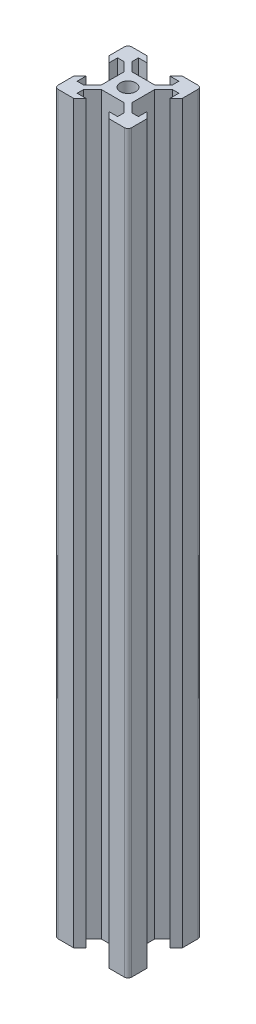
from build123d import *

# Parameters (mm, degrees)
MASTERLAYOUTSKETCH_R  = 2.1
MAIN_EXTRUSION_DEPTH  = 200
EDGE_FILLETS_R        = 1
M5_TAPPED_HOLE1_D     = 4.2
M5_TAPPED_HOLE1_DEPTH = 12.4
M5_TAPPED_HOLE1_TIP   = 1.2618073


with BuildPart() as part:
    # MasterLayoutSketch → Main Extrusion (new body)
    with BuildSketch(Plane(origin=(0, 0, 0), x_dir=(1, 0, 0), z_dir=(0, 1, 0))):
        Polygon((-8.325, 3.1), (-8.325, 5.5), (-6.560660172, 5.5), (-4.160660172, 3.1), (-4.160660172, -3.1), (-6.560660172, -5.5), (-8.325, -5.5), (-8.325, -3.1), (-10, -4.775), (-10, -10), (-4.775, -10), (-3.1, -8.325), (-5.5, -8.325), (-5.5, -6.560660172), (-3.1, -4.160660172), (3.1, -4.160660172), (5.5, -6.560660172), (5.5, -8.325), (3.1, -8.325), (4.775, -10), (10, -10), (10, -4.775), (8.325, -3.1), (8.325, -5.5), (6.560660172, -5.5), (4.160660172, -3.1), (4.160660172, 3.1), (6.560660172, 5.5), (8.325, 5.5), (8.325, 3.1), (10, 4.775), (10, 10), (4.775, 10), (3.1, 8.325), (5.5, 8.325), (5.5, 6.560660172), (3.1, 4.160660172), (-3.1, 4.160660172), (-5.5, 6.560660172), (-5.5, 8.325), (-3.1, 8.325), (-4.775, 10), (-10, 10), (-10, 4.775), align=None)
        with Locations(Location((0, 0, 0), (0, 0, 90))):
            Circle(MASTERLAYOUTSKETCH_R, mode=Mode.SUBTRACT)
    extrude(amount=MAIN_EXTRUSION_DEPTH)

    # Edge Fillets
    edge_fillets_edges = [part.edges().sort_by_distance(p)[0] for p in [
        (10, 100, -10),
        (10, 100, 10),
        (-10, 100, 10),
        (-10, 100, -10),
    ]]
    fillet(edge_fillets_edges, radius=EDGE_FILLETS_R)

    # M5 Tapped Hole1
    with Locations(Plane(origin=(0, 0, 0), x_dir=(-1, 0, 0), z_dir=(0, -1, 0))):
        with Locations((0, 0)):
            Hole(M5_TAPPED_HOLE1_D / 2, depth=M5_TAPPED_HOLE1_DEPTH)
            with Locations((0, 0, -(M5_TAPPED_HOLE1_DEPTH + M5_TAPPED_HOLE1_TIP / 2))):  # 118° drill point
                Cone(0, M5_TAPPED_HOLE1_D / 2, M5_TAPPED_HOLE1_TIP, mode=Mode.SUBTRACT)


solid = part.part
